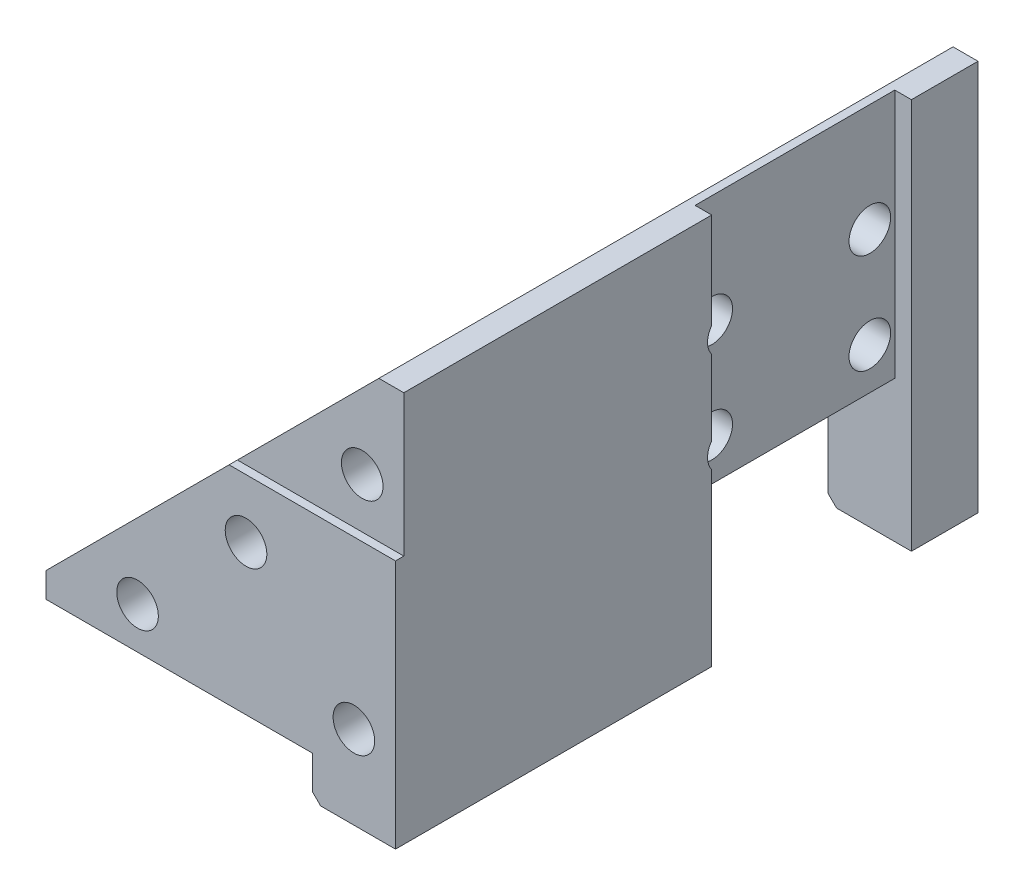
from build123d import *

# Parameters (mm, degrees)
EXTRUDE_1_DEPTH      = 70
SKETCH_2_W           = 45.532219889
SKETCH_2_H           = 5
CUT_EXTRUDE_1_DEPTH  = 100.498743711
SKETCH_3_W           = 35
SKETCH_3_H           = 10
SKETCH_3_H_2         = 46.866381138
CUT_EXTRUDE_2_DEPTH  = 98.082439195
CUT_EXTRUDE_3_DEPTH  = 100.498743711
CUT_EXTRUDE_7_REACH  = 101.499
SKETCH_9_R           = 2.5
CHAMFER_1_SIZE       = 1
SKETCH_11_R          = 3.75
CUT_EXTRUDE_10_DEPTH = 8
CUT_EXTRUDE_11_DEPTH = 100.498743711
CUT_EXTRUDE_12_DEPTH = 1
SKETCH_15_W          = 24
SKETCH_15_H          = 17
CUT_EXTRUDE_14_DEPTH = 10
SKETCH_16_R          = 2.5
CUT_EXTRUDE_15_DEPTH = 91.183146984
SKETCH_17_W          = 24
SKETCH_17_H          = 30
CUT_EXTRUDE_16_DEPTH = 2
SKETCH_7_R           = 2.5
CUT_EXTRUDE_17_DEPTH = 80.429213769
CHAMFER_2_SIZE       = 1
CHAMFER_3_SIZE       = 1


with BuildPart() as part:
    # 草图1 → 拉伸1 (new body)
    with BuildSketch(Plane.XY):
        Polygon((0, 0), (50, 0), (50, 50), align=None)
    extrude(amount=EXTRUDE_1_DEPTH)

    # 草图2 → 切除-拉伸1 (cut, through all)
    with BuildSketch(Plane.XY.offset(70)):
        with Locations((17.233890055, 2.5)):
            Rectangle(SKETCH_2_W, SKETCH_2_H)
    extrude(amount=-CUT_EXTRUDE_1_DEPTH, mode=Mode.SUBTRACT)

    # 草图3 → 切除-拉伸2 (cut, through all)
    with BuildSketch(Plane.XZ.offset(-5)):
        with Locations((22.5, 55)):
            Rectangle(SKETCH_3_W, SKETCH_3_H)
        with Locations((22.5, 16.566809431)):
            Rectangle(SKETCH_3_W, SKETCH_3_H_2)
    extrude(amount=-CUT_EXTRUDE_2_DEPTH, mode=Mode.SUBTRACT)

    # 草图4 → 切除-拉伸3 (cut, through all)
    with BuildSketch(Plane.XY.offset(70)):
        Polygon((5, 5), (8, 5), (8, 8), align=None)
    extrude(amount=-CUT_EXTRUDE_3_DEPTH, mode=Mode.SUBTRACT)

    # 切除-拉伸7: up to this face of the body (flat: up to its plane)
    cut_extrude_7_end = Plane(part.part.faces().sort_by_distance((28.49122807, 16.745614035, 50))[0])
    # 草图9 → 切除-拉伸7 (cut, up to the picked face)
    with BuildSketch(Plane.XY.offset(70), mode=Mode.PRIVATE) as cut_extrude_7_sk1:
        with Locations((45, 36)):
            Circle(SKETCH_9_R)
    cut_extrude_7_tool1 = split(extrude(cut_extrude_7_sk1.sketch, amount=-CUT_EXTRUDE_7_REACH, mode=Mode.PRIVATE), bisect_by=cut_extrude_7_end, keep=Keep.BOTH, mode=Mode.PRIVATE)
    # 草图9 → 切除-拉伸7 (cut, up to the picked face)
    with BuildSketch(Plane.XY.offset(70), mode=Mode.PRIVATE) as cut_extrude_7_sk2:
        with Locations((45, 10)):
            Circle(SKETCH_9_R)
    cut_extrude_7_tool2 = split(extrude(cut_extrude_7_sk2.sketch, amount=-CUT_EXTRUDE_7_REACH, mode=Mode.PRIVATE), bisect_by=cut_extrude_7_end, keep=Keep.BOTH, mode=Mode.PRIVATE)
    # 草图9 → 切除-拉伸7 (cut, up to the picked face)
    with BuildSketch(Plane.XY.offset(70), mode=Mode.PRIVATE) as cut_extrude_7_sk3:
        with Locations((19, 10)):
            Circle(SKETCH_9_R)
    cut_extrude_7_tool3 = split(extrude(cut_extrude_7_sk3.sketch, amount=-CUT_EXTRUDE_7_REACH, mode=Mode.PRIVATE), bisect_by=cut_extrude_7_end, keep=Keep.BOTH, mode=Mode.PRIVATE)
    add(cut_extrude_7_tool1.solids().sort_by(Axis((45, 36, 70), (0, 0, -1)))[0], mode=Mode.SUBTRACT)
    add(cut_extrude_7_tool2.solids().sort_by(Axis((45, 10, 70), (0, 0, -1)))[0], mode=Mode.SUBTRACT)
    add(cut_extrude_7_tool3.solids().sort_by(Axis((19, 10, 70), (0, 0, -1)))[0], mode=Mode.SUBTRACT)

    # 倒角1
    chamfer_1_edges = [part.edges().sort_by_distance(p)[0] for p in [
        (24, 5, 60),
        (24, 5, 40),
        (24, 5, 50),
    ]]
    chamfer(chamfer_1_edges, length=CHAMFER_1_SIZE)

    # 草图11 → 切除-拉伸10 (cut)
    with BuildSketch(Plane.XZ.offset(-5)):
        with Locations((34, 65)):
            Circle(SKETCH_11_R)
    extrude(amount=-CUT_EXTRUDE_10_DEPTH, mode=Mode.SUBTRACT)

    # 草图13 → 切除-拉伸11 (cut, through all)
    with BuildSketch(Plane.XY.offset(70)):
        Polygon((50, 50), (47, 47), (50, 47), align=None)
    extrude(amount=-CUT_EXTRUDE_11_DEPTH, mode=Mode.SUBTRACT)

    # 草图14 → 切除-拉伸12 (cut)
    with BuildSketch(Plane.XY.offset(70)):
        Polygon((50, 47), (47, 47), (30, 30), (50, 30), align=None)
    extrude(amount=-CUT_EXTRUDE_12_DEPTH, mode=Mode.SUBTRACT)

    # 草图15 → 切除-拉伸14 (cut)
    with BuildSketch(Plane.ZY.offset(-40)):
        with Locations((20, 8.5)):
            Rectangle(SKETCH_15_W, SKETCH_15_H)
    extrude(amount=-CUT_EXTRUDE_14_DEPTH, mode=Mode.SUBTRACT)

    # 草图16 → 切除-拉伸15 (cut, through all)
    with BuildSketch(Plane.ZY.offset(-40)):
        with Locations((30, 34)):
            Circle(SKETCH_16_R)
        with Locations((30, 22)):
            Circle(SKETCH_16_R)
        with Locations((11, 34)):
            Circle(SKETCH_16_R)
        with Locations((11, 22)):
            Circle(SKETCH_16_R)
    extrude(amount=-CUT_EXTRUDE_15_DEPTH, mode=Mode.SUBTRACT)

    # 草图17 → 切除-拉伸16 (cut)
    with BuildSketch(Plane(origin=(50, 0, 0), x_dir=(0, 0, -1), z_dir=(1, 0, 0))):
        with Locations((-20, 32)):
            Rectangle(SKETCH_17_W, SKETCH_17_H)
    extrude(amount=-CUT_EXTRUDE_16_DEPTH, mode=Mode.SUBTRACT)

    # 草图7 → 切除-拉伸17 (cut, through all)
    with BuildSketch(Plane(origin=(0, 0, 40), x_dir=(-1, 0, 0), z_dir=(0, 0, -1))):
        with Locations((-32.036330274, 22.963669726)):
            Circle(SKETCH_7_R)
    extrude(amount=-CUT_EXTRUDE_17_DEPTH, mode=Mode.SUBTRACT)

    # 倒角2
    chamfer_2_edges = [part.edges().sort_by_distance(p)[0] for p in [
        (40, 0, 51),
    ]]
    chamfer(chamfer_2_edges, length=CHAMFER_2_SIZE)

    # 倒角3
    chamfer_3_edges = [part.edges().sort_by_distance(p)[0] for p in [
        (40, 0, 4),
    ]]
    chamfer(chamfer_3_edges, length=CHAMFER_3_SIZE)


solid = part.part
